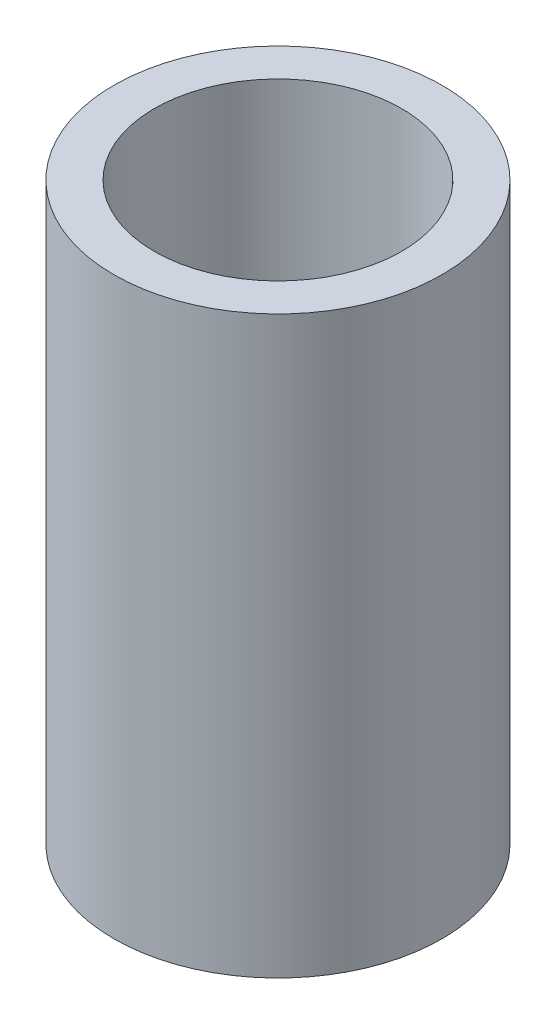
from build123d import *

# Parameters (mm, degrees)
SKETCH1_R           = 6.35
SKETCH1_R_2         = 4.7879
BOSS_EXTRUDE1_DEPTH = 22.25675


with BuildPart() as part:
    # Sketch1 → Boss-Extrude1 (new body)
    with BuildSketch(Plane(origin=(0, 0, 0), x_dir=(1, 0, 0), z_dir=(0, 1, 0))):
        with Locations(Location((0, 0, 0), (0, 0, 270))):
            Circle(SKETCH1_R)
        with Locations(Location((0, 0, 0), (0, 0, 270))):
            Circle(SKETCH1_R_2, mode=Mode.SUBTRACT)
    extrude(amount=BOSS_EXTRUDE1_DEPTH)


solid = part.part
